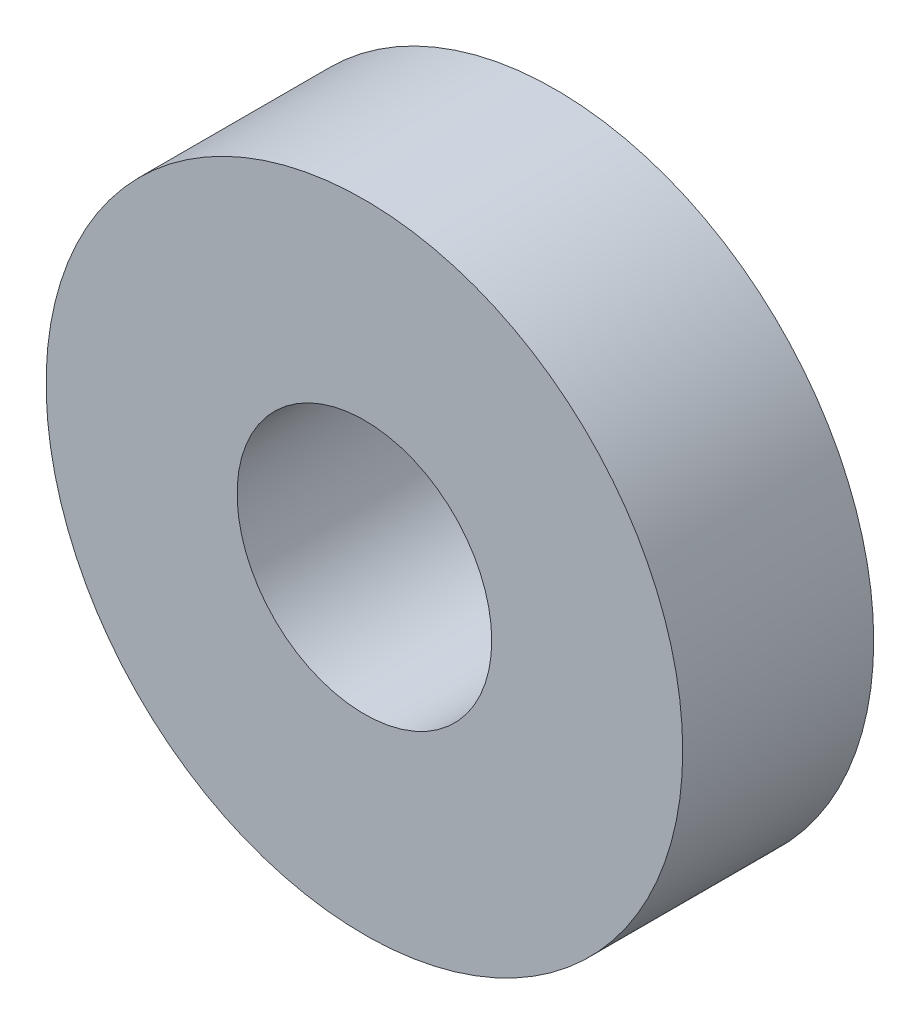
from build123d import *

# Parameters (mm, degrees)
SKETCH1_R           = 4
SKETCH1_R_2         = 1.6
BOSS_EXTRUDE1_DEPTH = 2.4


with BuildPart() as part:
    # Sketch1 → Boss-Extrude1 (new body)
    with BuildSketch(Plane.XY):
        Circle(SKETCH1_R)
        Circle(SKETCH1_R_2, mode=Mode.SUBTRACT)
    extrude(amount=BOSS_EXTRUDE1_DEPTH)


solid = part.part
